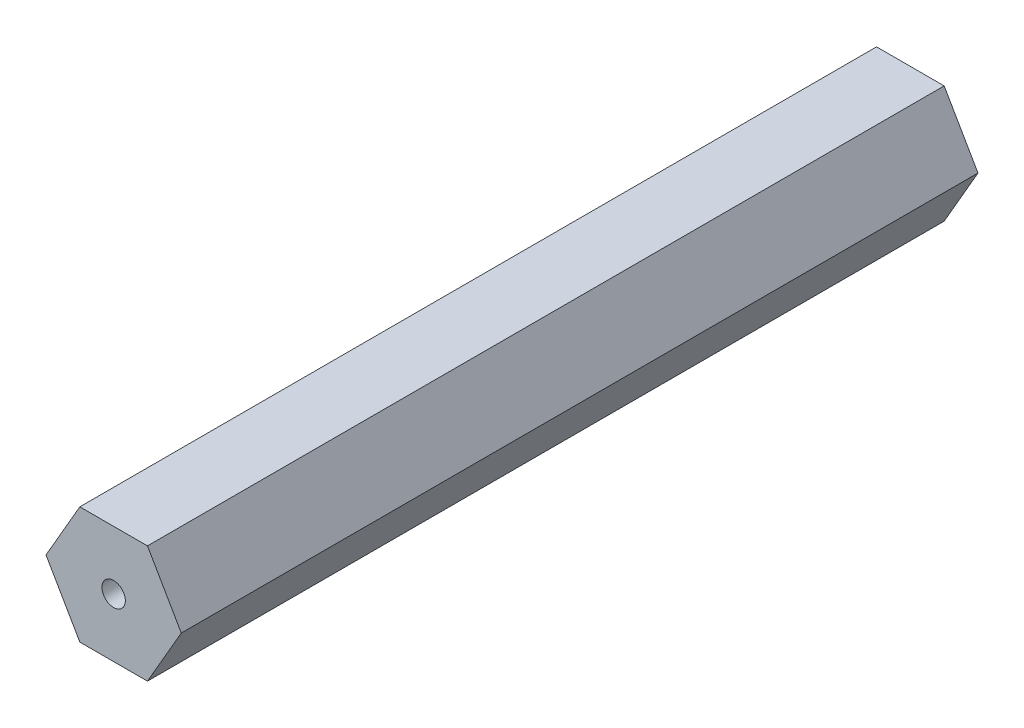
from build123d import *

# Parameters (mm, degrees)
SKETCH1_R           = 1.27
BOSS_EXTRUDE1_DEPTH = 86.36


with BuildPart() as part:
    # Sketch1 → Boss-Extrude1 (new body)
    with BuildSketch(Plane.XY):
        Polygon((8.435445083, 1.184206714), (4.769270874, 7.534206714), (-2.563077545, 7.534206714), (-6.229251754, 1.184206714), (-2.563077545, -5.165793286), (4.769270874, -5.165793286), align=None)
        with Locations((1.103096665, 1.184206714)):
            Circle(SKETCH1_R, mode=Mode.SUBTRACT)
    extrude(amount=BOSS_EXTRUDE1_DEPTH)


solid = part.part
